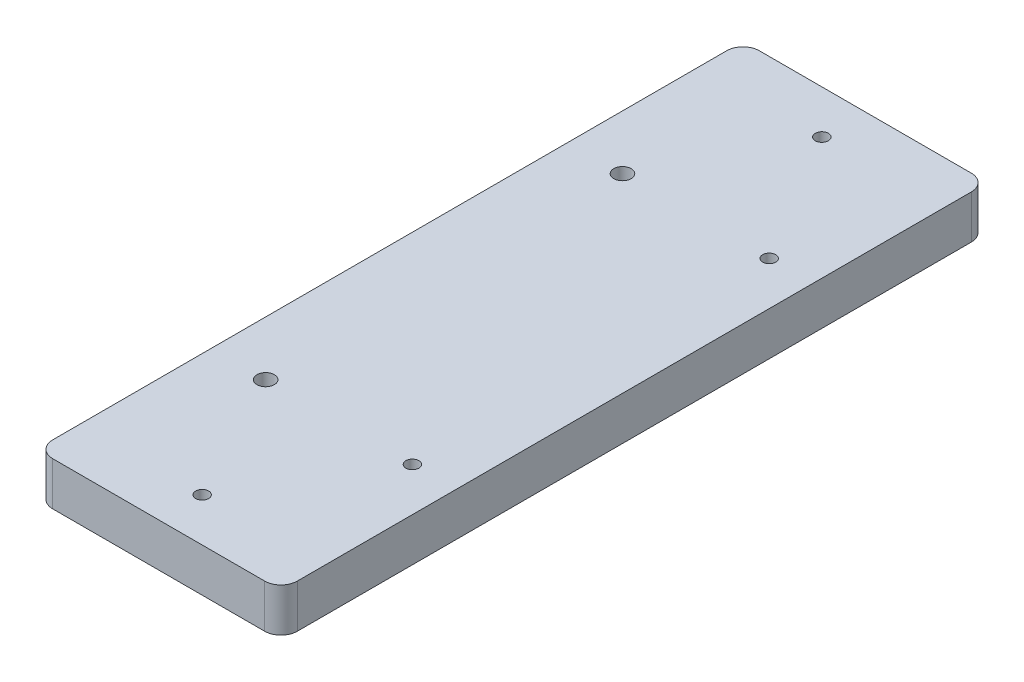
from build123d import *

# Parameters (mm, degrees)
SKETCH1_W           = 45
SKETCH1_H           = 130
SKETCH1_R           = 1.6
SKETCH1_R_2         = 1.2
BOSS_EXTRUDE1_DEPTH = 8
FILLET1_R           = 3


with BuildPart() as part:
    # Sketch1 → Boss-Extrude1 (new body)
    with BuildSketch(Plane(origin=(0, 0, 0), x_dir=(1, 0, 0), z_dir=(0, 1, 0))):
        with Locations((22.5, 65)):
            Rectangle(SKETCH1_W, SKETCH1_H)
        with Locations(Location((10, 97.825, 0), (0, 0, 270))):
            Circle(SKETCH1_R, mode=Mode.SUBTRACT)
        with Locations(Location((10, 32.175, 0), (0, 0, 270))):
            Circle(SKETCH1_R, mode=Mode.SUBTRACT)
        with Locations(Location((37, 97.825, 0), (0, 0, 270))):
            Circle(SKETCH1_R_2, mode=Mode.SUBTRACT)
        with Locations(Location((37, 32.175, 0), (0, 0, 270))):
            Circle(SKETCH1_R_2, mode=Mode.SUBTRACT)
        with Locations(Location((22.5, 8, 0), (0, 0, 270))):
            Circle(SKETCH1_R_2, mode=Mode.SUBTRACT)
        with Locations(Location((22.5, 122, 0), (0, 0, 270))):
            Circle(SKETCH1_R_2, mode=Mode.SUBTRACT)
    extrude(amount=BOSS_EXTRUDE1_DEPTH)

    # Fillet1
    fillet1_edges = [part.edges().sort_by_distance(p)[0] for p in [
        (0, 4, 0),
        (0, 4, -130),
        (45, 4, -130),
        (45, 4, 0),
    ]]
    fillet(fillet1_edges, radius=FILLET1_R)


solid = part.part
